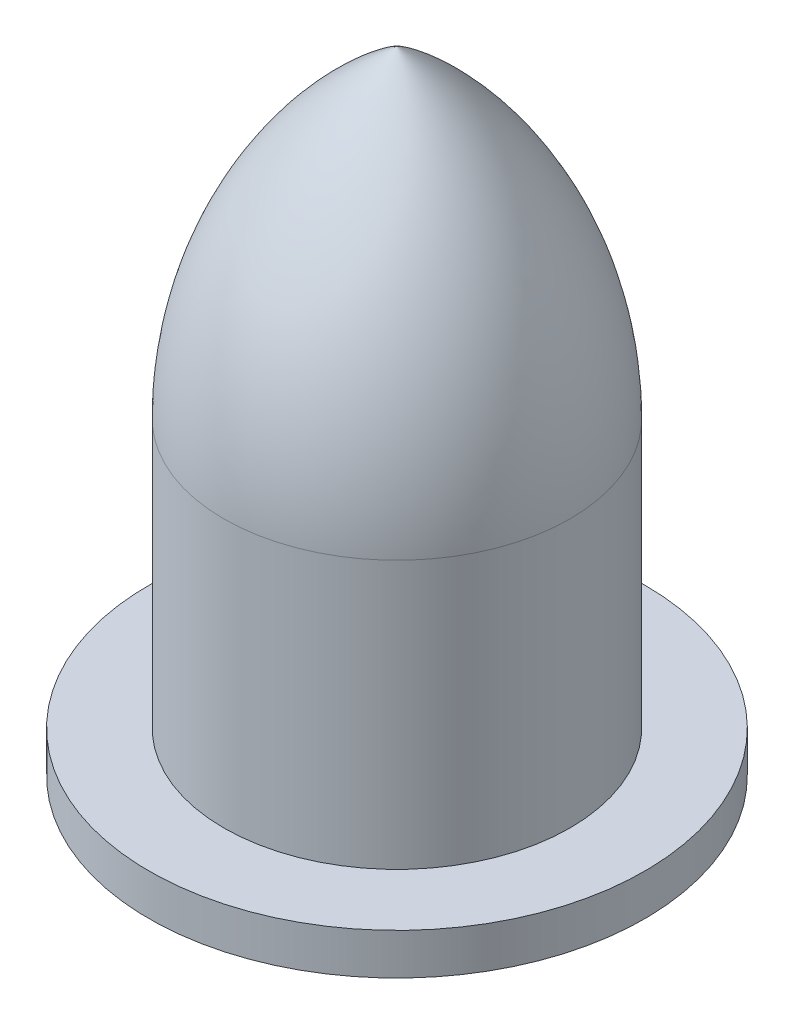
from build123d import *


with BuildPart() as part:
    # Sketch1 → Revolve1 (revolve)
    with BuildSketch(Plane.XY, mode=Mode.PRIVATE) as revolve1_sk:
        with BuildLine():
            Line((6, 14.894940841), (6, 15.894940841))
            Line((6, 15.894940841), (4.191247689, 15.894940841))
            Line((4.191247689, 15.894940841), (4.191247689, 22.377632021))
            ThreePointArc((4.191247689, 22.377632021), (3.077336376, 26.812631299), (0, 30.194940841))
            Line((0, 30.194940841), (0, 23.973206496))
            Line((0, 23.973206496), (2.5, 22.164746505))
            Line((2.5, 22.164746505), (2.5, 14.894940841))
            Line((2.5, 14.894940841), (6, 14.894940841))
        make_face()
    revolve(revolve1_sk.sketch.rotate(Axis((0, 0, 0), (0, 1, 0)), 90), axis=Axis((0, 0, 0), (0, 1, 0)))


solid = part.part
